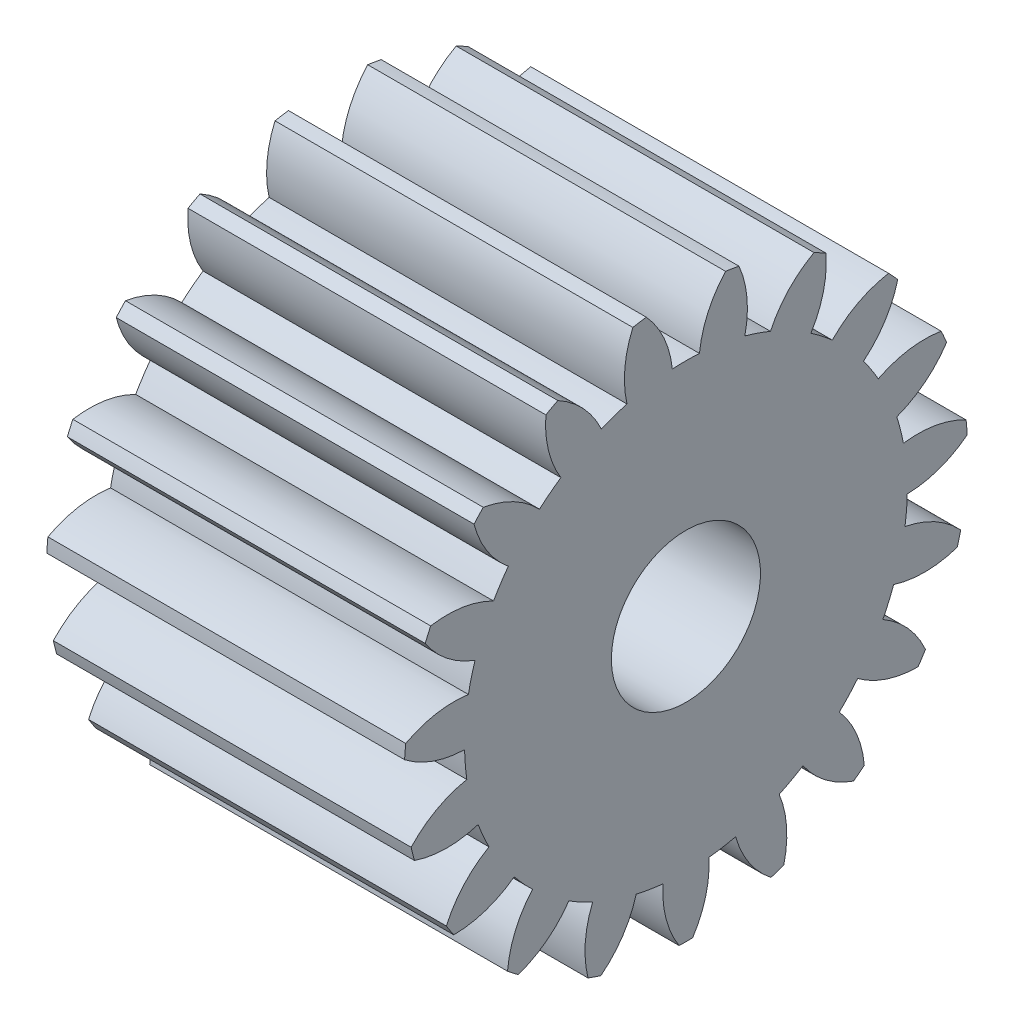
from build123d import *

# Parameters (mm, degrees)
BASPROSKE_W     = 12
BASPROSKE_H     = 9.45
TOOTHCUT_DEPTH  = 18.9612082
TEETHCUTS_COUNT = 19
TEETHCUTS_ANGLE = 341.052631579
BORSKE_R        = 2.5
BORE_DEPTH      = 50.0000508


with BuildPart() as part:
    # BasProSke → Base-Revolve (revolve)
    with BuildSketch(Plane(origin=(0, 0, 0), x_dir=(1, 0, 0), z_dir=(0, 1, 0)), mode=Mode.PRIVATE) as base_revolve_sk:
        with Locations((6, 4.725)):
            Rectangle(BASPROSKE_W, BASPROSKE_H)
    revolve(base_revolve_sk.sketch.rotate(Axis((-10, 0, 0), (1, 0, 0)), 180), axis=Axis((-10, 0, 0), (1, 0, 0)))

    # TooCutSke → ToothCut (cut, through all)
    with BuildSketch(Plane(origin=(0, 0, 0), x_dir=(0, 0, -1), z_dir=(1, 0, 0))):
        with BuildLine():
            ThreePointArc((0.454207509, 7.410092546), (0, 7.424), (-0.454207509, 7.410092546))
            ThreePointArc((-0.454207509, 7.410092546), (-0.742938902, 8.467115597), (-1.351140968, 9.378572559))
            ThreePointArc((-1.351140968, 9.378572559), (0, 9.4754), (1.351140968, 9.378572559))
            ThreePointArc((1.351140968, 9.378572559), (0.742938902, 8.467115597), (0.454207509, 7.410092546))
        make_face()
    toothcut = extrude(amount=TOOTHCUT_DEPTH, mode=Mode.SUBTRACT)

    # TeethCuts: ToothCut ×19 about axis
    teethcuts_axis = Axis((-10, 0, 0), (1, 0, 0))
    for i in range(1, TEETHCUTS_COUNT):
        add(toothcut.rotate(teethcuts_axis, i * TEETHCUTS_ANGLE / (TEETHCUTS_COUNT - 1)), mode=Mode.SUBTRACT)

    # BorSke → Bore (cut, symmetric)
    with BuildSketch(Plane(origin=(0, 0, 0), x_dir=(0, 0, -1), z_dir=(1, 0, 0))):
        with Locations(Location((0, 0, 0), (0, 0, 180))):
            Circle(BORSKE_R)
    extrude(amount=BORE_DEPTH, both=True, mode=Mode.SUBTRACT)


solid = part.part
